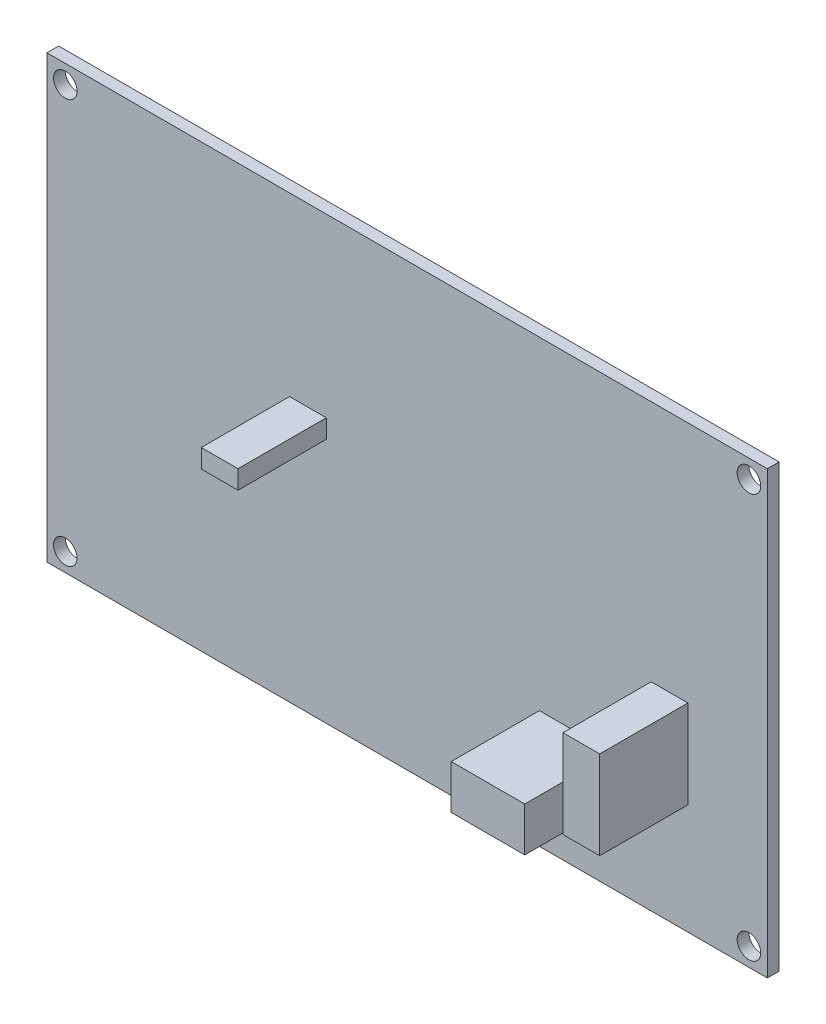
from build123d import *

# Parameters (mm, degrees)
ESQUISSE1_W               = 98
ESQUISSE1_H               = 60
BOSS_EXTRU_1_DEPTH        = 1.6
ESQUISSE2_R               = 1.6
ENL_V_MAT_EXTRU_1_DEPTH   = 58.476603936
SYM_TRIE2_COPY_1_SKETCH_R = 1.6
SYM_TRIE2_COPY_1_DEPTH    = 58.476603936
ESQUISSE3_W               = 5
ESQUISSE3_H               = 12
ESQUISSE3_W_2             = 10
ESQUISSE3_H_2             = 6
ESQUISSE3_H_3             = 2.54
BOSS_EXTRU_2_DEPTH        = 12


with BuildPart() as part:
    # Esquisse1 → Boss.-Extru.1 (new body)
    with BuildSketch(Plane.XY):
        Rectangle(ESQUISSE1_W, ESQUISSE1_H)
    extrude(amount=BOSS_EXTRU_1_DEPTH)

    # Esquisse2 → Enlèv. mat.-Extru.1 (cut, through all)
    with BuildSketch(Plane.XY.offset(1.6)):
        with Locations((-46.5, 27.5)):
            Circle(ESQUISSE2_R)
    enl_v_mat_extru_1 = extrude(amount=-ENL_V_MAT_EXTRU_1_DEPTH, mode=Mode.SUBTRACT)

    # Symétrie1: Enlèv. mat.-Extru.1 across plane
    add(enl_v_mat_extru_1.mirror(Plane.ZX), mode=Mode.SUBTRACT)

    # Symétrie2: Enlèv. mat.-Extru.1 across plane
    add(enl_v_mat_extru_1.mirror(Plane(origin=(0, 0, 0), x_dir=(0, 0, 1), z_dir=(1, 0, 0))), mode=Mode.SUBTRACT)

    # Symétrie2 copy 1 sketch → Symétrie2 copy 1 (cut, through all)
    with BuildSketch(Plane(origin=(0, 0, 1.6), x_dir=(-1, 0, 0), z_dir=(0, 0, 1))):
        with Locations((-46.5, 27.5)):
            Circle(SYM_TRIE2_COPY_1_SKETCH_R)
    extrude(amount=-SYM_TRIE2_COPY_1_DEPTH, mode=Mode.SUBTRACT)

    # Esquisse3 → Boss.-Extru.2 (add)
    with BuildSketch(Plane.XY.offset(1.6)):
        with Locations((35.7, -9)):
            Rectangle(ESQUISSE3_W, ESQUISSE3_H)
        with Locations((23, -17)):
            Rectangle(ESQUISSE3_W_2, ESQUISSE3_H_2)
        with Locations((-13.5, 4.73)):
            Rectangle(ESQUISSE3_W, ESQUISSE3_H_3)
    extrude(amount=BOSS_EXTRU_2_DEPTH)


solid = part.part
